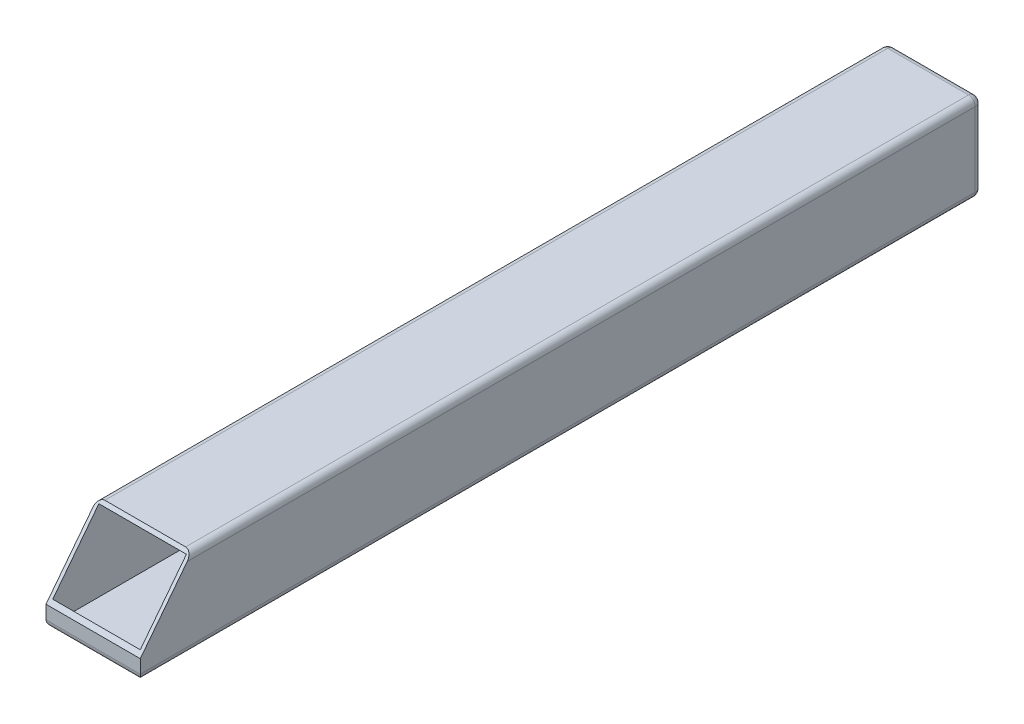
from build123d import *

# Parameters (mm, degrees)
SKETCH1_W           = 177.8
SKETCH1_H           = 1587.5
BOSS_EXTRUDE1_DEPTH = 165.1
CUT_EXTRUDE1_DEPTH  = 177.8
SHELL2_T            = -6.35
FILLET3_R           = 12.7


with BuildPart() as part:
    # Sketch1 → Boss-Extrude1 (new body)
    with BuildSketch(Plane(origin=(0, 0, 0), x_dir=(1, 0, 0), z_dir=(0, 1, 0))):
        with Locations((88.9, 793.75)):
            Rectangle(SKETCH1_W, SKETCH1_H)
    extrude(amount=BOSS_EXTRUDE1_DEPTH)

    # Sketch2 → Cut-Extrude1 (cut)
    with BuildSketch(Plane(origin=(177.8, 0, 0), x_dir=(0, 0, -1), z_dir=(1, 0, 0))):
        Polygon((0, 165.1), (98.317886998, 165.1), (0, 38.1), align=None)
    extrude(amount=-CUT_EXTRUDE1_DEPTH, mode=Mode.SUBTRACT)

    # Shell2
    shell2_openings = [part.faces().sort_by_distance(p)[0] for p in [
        (88.9, 101.6, -49.158943499),
    ]]
    offset(amount=SHELL2_T, openings=shell2_openings, kind=Kind.INTERSECTION)

    # Fillet3
    fillet3_edges = [part.edges().sort_by_distance(p)[0] for p in [
        (177.8, 165.1, -842.908943499),
        (88.9, 165.1, -1587.5),
        (0, 165.1, -842.908943499),
        (88.9, 0, -1587.5),
        (177.8, 0, -793.75),
        (88.9, 0, 0),
        (0, 0, -793.75),
        (0, 82.55, -1587.5),
        (177.8, 82.55, -1587.5),
    ]]
    fillet(fillet3_edges, radius=FILLET3_R)


solid = part.part
